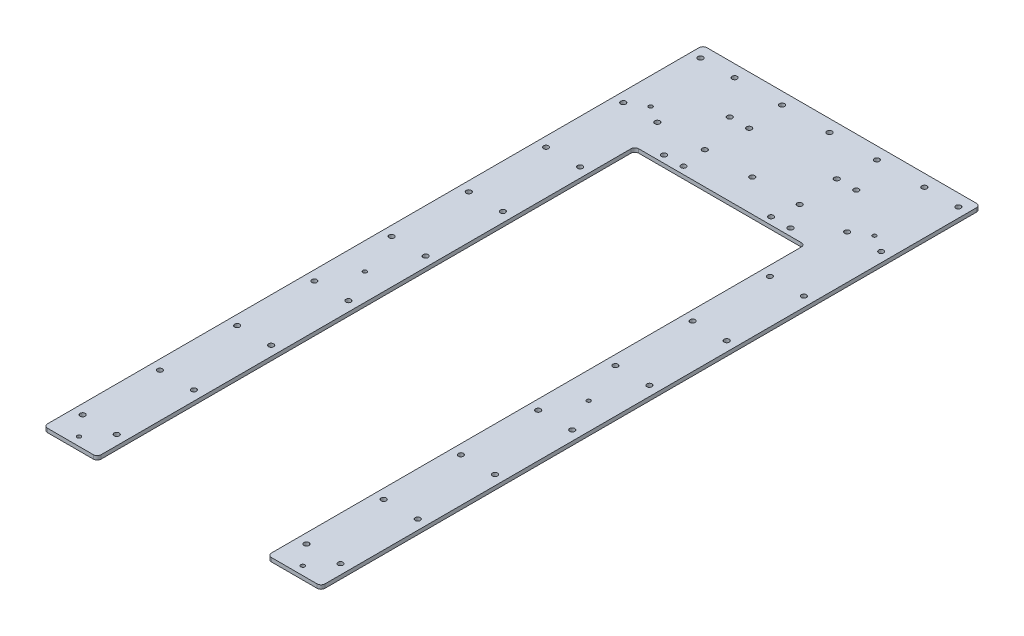
from build123d import *

# Parameters (mm, degrees)
SKETCH1_R           = 2.1
SKETCH1_R_2         = 1.6
BOSS_EXTRUDE1_DEPTH = 3.175
FILLET1_R           = 3.2


with BuildPart() as part:
    # Sketch1 → Boss-Extrude1 (new body)
    with BuildSketch(Plane(origin=(0, 0, 0), x_dir=(1, 0, 0), z_dir=(0, 1, 0))):
        Polygon((-114, -271), (-70, -271), (-70, 171), (70, 171), (70, -271), (114, -271), (114, 271), (-114, 271), align=None)
        with Locations(Location((106, 261, 0), (0, 0, 270))):
            Circle(SKETCH1_R, mode=Mode.SUBTRACT)
        with Locations(Location((106, 197.5, 0), (0, 0, 270))):
            Circle(SKETCH1_R, mode=Mode.SUBTRACT)
        with Locations(Location((106, 134, 0), (0, 0, 270))):
            Circle(SKETCH1_R, mode=Mode.SUBTRACT)
        with Locations(Location((106, 70.5, 0), (0, 0, 270))):
            Circle(SKETCH1_R, mode=Mode.SUBTRACT)
        with Locations(Location((106, 7, 0), (0, 0, 270))):
            Circle(SKETCH1_R, mode=Mode.SUBTRACT)
        with Locations(Location((106, -56.5, 0), (0, 0, 270))):
            Circle(SKETCH1_R, mode=Mode.SUBTRACT)
        with Locations(Location((106, -120, 0), (0, 0, 270))):
            Circle(SKETCH1_R, mode=Mode.SUBTRACT)
        with Locations(Location((106, -183.5, 0), (0, 0, 270))):
            Circle(SKETCH1_R, mode=Mode.SUBTRACT)
        with Locations(Location((78, -247, 0), (0, 0, 270))):
            Circle(SKETCH1_R, mode=Mode.SUBTRACT)
        with Locations(Location((78, -183.5, 0), (0, 0, 270))):
            Circle(SKETCH1_R, mode=Mode.SUBTRACT)
        with Locations(Location((78, -120, 0), (0, 0, 270))):
            Circle(SKETCH1_R, mode=Mode.SUBTRACT)
        with Locations(Location((78, -56.5, 0), (0, 0, 270))):
            Circle(SKETCH1_R, mode=Mode.SUBTRACT)
        with Locations(Location((78, 7, 0), (0, 0, 270))):
            Circle(SKETCH1_R, mode=Mode.SUBTRACT)
        with Locations(Location((78, 70.5, 0), (0, 0, 270))):
            Circle(SKETCH1_R, mode=Mode.SUBTRACT)
        with Locations(Location((78, 134, 0), (0, 0, 270))):
            Circle(SKETCH1_R, mode=Mode.SUBTRACT)
        with Locations(Location((78, 197.5, 0), (0, 0, 270))):
            Circle(SKETCH1_R, mode=Mode.SUBTRACT)
        with Locations(Location((78, 261, 0), (0, 0, 270))):
            Circle(SKETCH1_R, mode=Mode.SUBTRACT)
        with Locations(Location((92, -29, 0), (0, 0, 270))):
            Circle(SKETCH1_R_2, mode=Mode.SUBTRACT)
        with Locations(Location((92, 206, 0), (0, 0, 270))):
            Circle(SKETCH1_R_2, mode=Mode.SUBTRACT)
        with Locations(Location((92, -264, 0), (0, 0, 270))):
            Circle(SKETCH1_R_2, mode=Mode.SUBTRACT)
        with Locations(Location((-106, 261, 0), (0, 0, 270))):
            Circle(SKETCH1_R, mode=Mode.SUBTRACT)
        with Locations(Location((-78, 261, 0), (0, 0, 270))):
            Circle(SKETCH1_R, mode=Mode.SUBTRACT)
        with Locations(Location((-92, 206, 0), (0, 0, 270))):
            Circle(SKETCH1_R_2, mode=Mode.SUBTRACT)
        with Locations(Location((-78, 70.5, 0), (0, 0, 270))):
            Circle(SKETCH1_R, mode=Mode.SUBTRACT)
        with Locations(Location((-106, 70.5, 0), (0, 0, 270))):
            Circle(SKETCH1_R, mode=Mode.SUBTRACT)
        with Locations(Location((-106, 134, 0), (0, 0, 270))):
            Circle(SKETCH1_R, mode=Mode.SUBTRACT)
        with Locations(Location((-106, 197.5, 0), (0, 0, 270))):
            Circle(SKETCH1_R, mode=Mode.SUBTRACT)
        with Locations(Location((-92, -264, 0), (0, 0, 270))):
            Circle(SKETCH1_R_2, mode=Mode.SUBTRACT)
        with Locations(Location((-92, -29, 0), (0, 0, 270))):
            Circle(SKETCH1_R_2, mode=Mode.SUBTRACT)
        with Locations(Location((-78, 7, 0), (0, 0, 270))):
            Circle(SKETCH1_R, mode=Mode.SUBTRACT)
        with Locations(Location((-78, -56.5, 0), (0, 0, 270))):
            Circle(SKETCH1_R, mode=Mode.SUBTRACT)
        with Locations(Location((-78, -120, 0), (0, 0, 270))):
            Circle(SKETCH1_R, mode=Mode.SUBTRACT)
        with Locations(Location((-78, -183.5, 0), (0, 0, 270))):
            Circle(SKETCH1_R, mode=Mode.SUBTRACT)
        with Locations(Location((-78, -247, 0), (0, 0, 270))):
            Circle(SKETCH1_R, mode=Mode.SUBTRACT)
        with Locations(Location((-106, -247, 0), (0, 0, 270))):
            Circle(SKETCH1_R, mode=Mode.SUBTRACT)
        with Locations(Location((-106, -183.5, 0), (0, 0, 270))):
            Circle(SKETCH1_R, mode=Mode.SUBTRACT)
        with Locations(Location((-106, -120, 0), (0, 0, 270))):
            Circle(SKETCH1_R, mode=Mode.SUBTRACT)
        with Locations(Location((-106, -56.5, 0), (0, 0, 270))):
            Circle(SKETCH1_R, mode=Mode.SUBTRACT)
        with Locations(Location((-106, 7, 0), (0, 0, 270))):
            Circle(SKETCH1_R, mode=Mode.SUBTRACT)
        with Locations(Location((-78, 197.5, 0), (0, 0, 270))):
            Circle(SKETCH1_R, mode=Mode.SUBTRACT)
        with Locations(Location((-78, 134, 0), (0, 0, 270))):
            Circle(SKETCH1_R, mode=Mode.SUBTRACT)
        with Locations(Location((-52, 177, 0), (0, 0, 270))):
            Circle(SKETCH1_R, mode=Mode.SUBTRACT)
        with Locations(Location((-36, 177, 0), (0, 0, 270))):
            Circle(SKETCH1_R, mode=Mode.SUBTRACT)
        with Locations(Location((-36, 231, 0), (0, 0, 270))):
            Circle(SKETCH1_R, mode=Mode.SUBTRACT)
        with Locations(Location((-52, 231, 0), (0, 0, 270))):
            Circle(SKETCH1_R, mode=Mode.SUBTRACT)
        with Locations(Location((36, 177, 0), (0, 0, 270))):
            Circle(SKETCH1_R, mode=Mode.SUBTRACT)
        with Locations(Location((52, 177, 0), (0, 0, 270))):
            Circle(SKETCH1_R, mode=Mode.SUBTRACT)
        with Locations(Location((52, 231, 0), (0, 0, 270))):
            Circle(SKETCH1_R, mode=Mode.SUBTRACT)
        with Locations(Location((36, 231, 0), (0, 0, 270))):
            Circle(SKETCH1_R, mode=Mode.SUBTRACT)
        with Locations(Location((-39, 197.5, 0), (0, 0, 270))):
            Circle(SKETCH1_R, mode=Mode.SUBTRACT)
        with Locations(Location((-39, 261, 0), (0, 0, 270))):
            Circle(SKETCH1_R, mode=Mode.SUBTRACT)
        with Locations(Location((106, -247, 0), (0, 0, 270))):
            Circle(SKETCH1_R, mode=Mode.SUBTRACT)
        with Locations(Location((0, 197.5, 0), (0, 0, 270))):
            Circle(SKETCH1_R, mode=Mode.SUBTRACT)
        with Locations(Location((0, 261, 0), (0, 0, 270))):
            Circle(SKETCH1_R, mode=Mode.SUBTRACT)
        with Locations(Location((39, 197.5, 0), (0, 0, 270))):
            Circle(SKETCH1_R, mode=Mode.SUBTRACT)
        with Locations(Location((39, 261, 0), (0, 0, 270))):
            Circle(SKETCH1_R, mode=Mode.SUBTRACT)
    extrude(amount=BOSS_EXTRUDE1_DEPTH)

    # Fillet1
    fillet1_edges = [part.edges().sort_by_distance(p)[0] for p in [
        (70, 1.5875, -171),
        (-70, 1.5875, -171),
        (-70, 1.5875, 271),
        (-114, 1.5875, 271),
        (-114, 1.5875, -271),
        (114, 1.5875, -271),
        (114, 1.5875, 271),
        (70, 1.5875, 271),
    ]]
    fillet(fillet1_edges, radius=FILLET1_R)


solid = part.part
